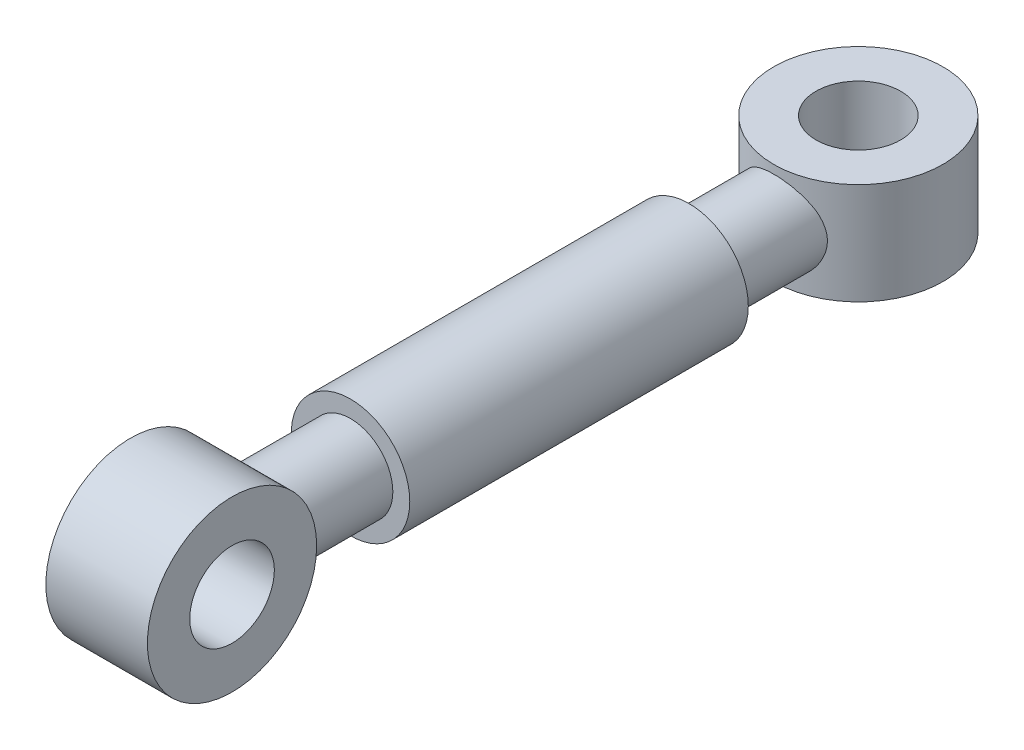
from build123d import *

# Parameters (mm, degrees)
SKETCH2_R           = 1.75
BOSS_EXTRUDE1_DEPTH = 5
SKETCH3_R           = 1.25
BOSS_EXTRUDE2_DEPTH = 8.5
SKETCH4_R           = 2.5
SKETCH4_R_2         = 1.25
BOSS_EXTRUDE3_DEPTH = 1.5
SKETCH5_R           = 2.5
SKETCH5_R_2         = 1.25
BOSS_EXTRUDE4_DEPTH = 1.5


with BuildPart() as part:
    # Sketch2 → Boss-Extrude1 (new, symmetric)
    with BuildSketch(Plane.XY):
        Circle(SKETCH2_R)
    extrude(amount=BOSS_EXTRUDE1_DEPTH, both=True)

    # Sketch3 → Boss-Extrude2 (add, symmetric)
    with BuildSketch(Plane.XY):
        Circle(SKETCH3_R)
    extrude(amount=BOSS_EXTRUDE2_DEPTH, both=True)

    # Sketch5 → Boss-Extrude4 (add, symmetric)
    with BuildSketch(Plane(origin=(0, 0, 0), x_dir=(0, 0, -1), z_dir=(1, 0, 0))):
        with Locations((-10, 0)):
            Circle(SKETCH5_R)
        with Locations((-10, 0)):
            Circle(SKETCH5_R_2, mode=Mode.SUBTRACT)
    extrude(amount=BOSS_EXTRUDE4_DEPTH, both=True)


with BuildPart() as body_2:
    # Sketch4 → Boss-Extrude3 (new, symmetric)
    with BuildSketch(Plane(origin=(0, 0, 0), x_dir=(1, 0, 0), z_dir=(0, 1, 0))):
        with Locations(Location((0, 10, 0), (0, 0, 270))):
            Circle(SKETCH4_R)
        with Locations(Location((0, 10, 0), (0, 0, 270))):
            Circle(SKETCH4_R_2, mode=Mode.SUBTRACT)
    extrude(amount=BOSS_EXTRUDE3_DEPTH, both=True)


solid = Compound([part.part, body_2.part])
